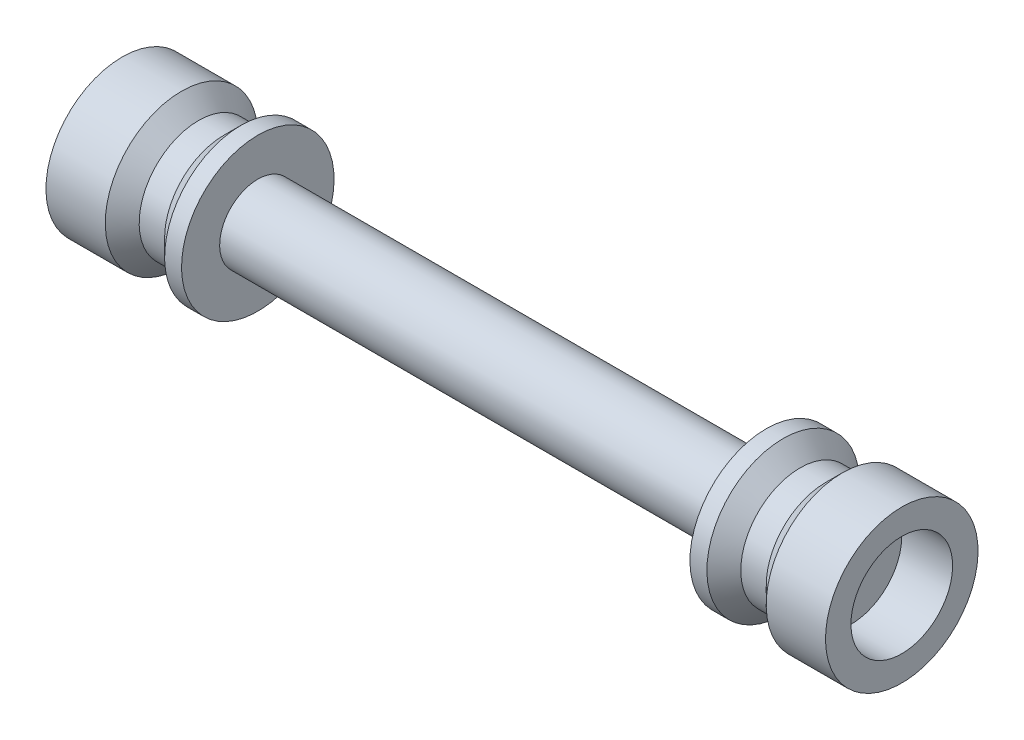
from build123d import *


with BuildPart() as part:
    # Esquisse1 → Révolution1 (revolve)
    with BuildSketch(Plane.XY):
        Polygon((0, 0), (-20, 0), (-20, 3), (-23, 3), (-23, 4.5), (-19.5, 4.5), (-18.5, 3.5), (-17, 3.5), (-16, 4.5), (-15, 4.5), (-15, 2.25), (15, 2.25), (15, 4.5), (16, 4.5), (17, 3.5), (18.5, 3.5), (19.5, 4.5), (23, 4.5), (23, 3), (20, 3), (20, 0), align=None)
    revolve(axis=Axis((0, 0, 0), (-1, 0, 0)))


solid = part.part
